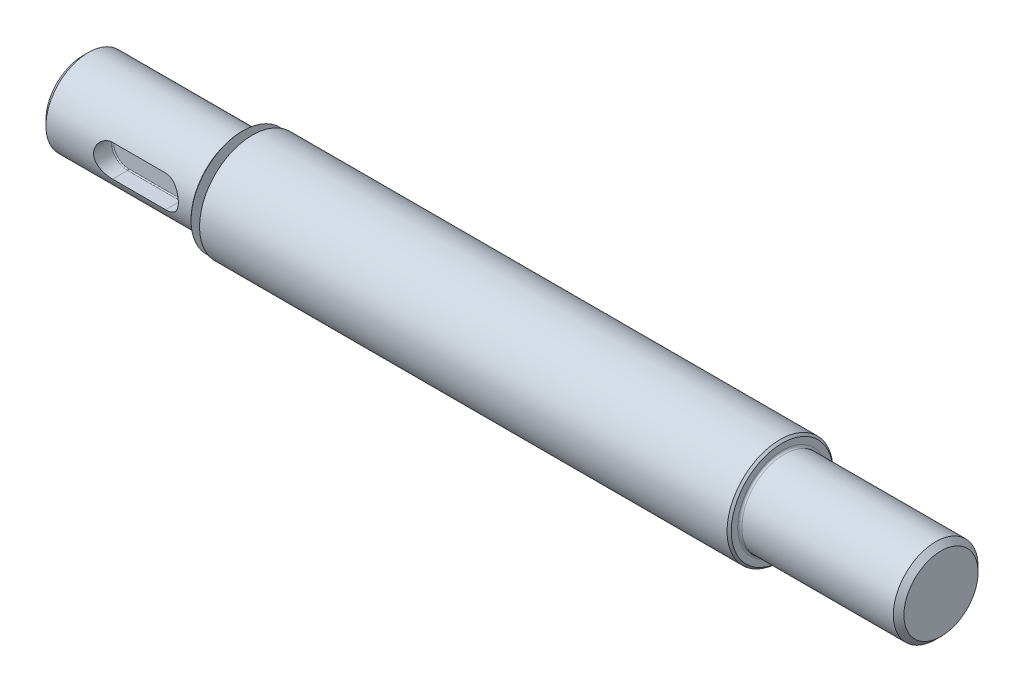
from build123d import *

# Parameters (mm, degrees)
CHAMFER1_SIZE        = 0.2
CHAMFER2_SIZE        = 0.2
CHAMFER3_SIZE        = 0.5
CHAMFER4_SIZE        = 0.5
FILLET1_R            = 0.2
FILLET2_R            = 0.2
SKETCH11_W           = 8
SKETCH11_H           = 3
BOSS_EXTRUDE10_DEPTH = 1.8
FILLET19_RADIUS      = 1.5
FILLET19_LENGTH      = 1.8
FILLET20_RADIUS      = 1.5
FILLET20_LENGTH      = 1.8
FILLET21_R           = 0.1
SKETCH21_W           = 0.9
SKETCH21_H           = 1.5


with BuildPart() as part:
    # Sketch1 → Revolve1 (revolve)
    with BuildSketch(Plane.XY, mode=Mode.PRIVATE) as revolve1_sk:
        Polygon((0, 0), (81, 0), (81, 4), (66, 4), (66, 5), (15, 5), (15, 4), (0, 4), align=None)
    revolve(revolve1_sk.sketch.rotate(Axis((0, 0, 0), (1, 0, 0)), 90), axis=Axis((0, 0, 0), (1, 0, 0)))

    # Chamfer1
    chamfer1_edges = [part.edges().sort_by_distance(p)[0] for p in [
        (66, 0, -5),
    ]]
    chamfer(chamfer1_edges, length=CHAMFER1_SIZE)

    # Chamfer2
    chamfer2_edges = [part.edges().sort_by_distance(p)[0] for p in [
        (15, 0, -5),
    ]]
    chamfer(chamfer2_edges, length=CHAMFER2_SIZE)

    # Chamfer3
    chamfer3_edges = [part.edges().sort_by_distance(p)[0] for p in [
        (0, 0, -4),
    ]]
    chamfer(chamfer3_edges, length=CHAMFER3_SIZE)

    # Chamfer4
    chamfer4_edges = [part.edges().sort_by_distance(p)[0] for p in [
        (81, 0, -4),
    ]]
    chamfer(chamfer4_edges, length=CHAMFER4_SIZE)

    # Fillet1
    fillet1_edges = [part.edges().sort_by_distance(p)[0] for p in [
        (15, 0, -4),
    ]]
    fillet(fillet1_edges, radius=FILLET1_R)

    # Fillet2
    fillet2_edges = [part.edges().sort_by_distance(p)[0] for p in [
        (66, 0, -4),
    ]]
    fillet(fillet2_edges, radius=FILLET2_R)


with BuildPart() as body_2:
    # Sketch11 → Boss-Extrude10 (new body)
    with BuildSketch(Plane.XY.offset(4)):
        with Locations((9, 0)):
            Rectangle(SKETCH11_W, SKETCH11_H)
    extrude(amount=-BOSS_EXTRUDE10_DEPTH)

    # Fillet19: full round fillet: the end face becomes a half cylinder, R = half its width
    fillet19_face = Plane((5, 0, 3.1), x_dir=(0, 0, 1), z_dir=(-1, 0, 0))  # on the end face: x along it, z out of the body
    fillet19_slab = fillet19_face.offset(-FILLET19_RADIUS / 2) * Box(FILLET19_LENGTH, 2 * FILLET19_RADIUS, FILLET19_RADIUS, mode=Mode.PRIVATE)  # the body's end, R deep
    fillet19_round = Plane((6.5, 0, 3.1), x_dir=(-1, 0, 0), z_dir=(0, 0, 1)) * Cylinder(FILLET19_RADIUS, FILLET19_LENGTH, mode=Mode.PRIVATE)  # its axis R under the face
    add(fillet19_slab - fillet19_round, mode=Mode.SUBTRACT)

    # Fillet20: full round fillet: the end face becomes a half cylinder, R = half its width
    fillet20_face = Plane((13, 0, 3.1), x_dir=(0, 0, -1), z_dir=(1, 0, 0))  # on the end face: x along it, z out of the body
    fillet20_slab = fillet20_face.offset(-FILLET20_RADIUS / 2) * Box(FILLET20_LENGTH, 2 * FILLET20_RADIUS, FILLET20_RADIUS, mode=Mode.PRIVATE)  # the body's end, R deep
    fillet20_round = Plane((11.5, 0, 3.1), x_dir=(1, 0, 0), z_dir=(0, 0, -1)) * Cylinder(FILLET20_RADIUS, FILLET20_LENGTH, mode=Mode.PRIVATE)  # its axis R under the face
    add(fillet20_slab - fillet20_round, mode=Mode.SUBTRACT)

    # Fillet21
    fillet21_edges = [body_2.edges().sort_by_distance(p)[0] for p in [
        (9, -1.5, 2.2),
        (5, 0, 2.2),
        (9, 1.5, 2.2),
        (13, 0, 2.2),
    ]]
    fillet(fillet21_edges, radius=FILLET21_R)


with BuildPart() as part_1:
    add(part.part)

    # Combine6: cut body 2
    add(body_2.part, mode=Mode.SUBTRACT)

    # Sketch21 → Cut-Revolve3 (revolve, cut)
    with BuildSketch(Plane.XY, mode=Mode.PRIVATE) as cut_revolve3_sk:
        with Locations((15.55, 4.25)):
            Rectangle(SKETCH21_W, SKETCH21_H)
    revolve(cut_revolve3_sk.sketch.rotate(Axis((0, 0, 0), (1, 0, 0)), 270), axis=Axis((0, 0, 0), (1, 0, 0)), mode=Mode.SUBTRACT)


solid = part_1.part
